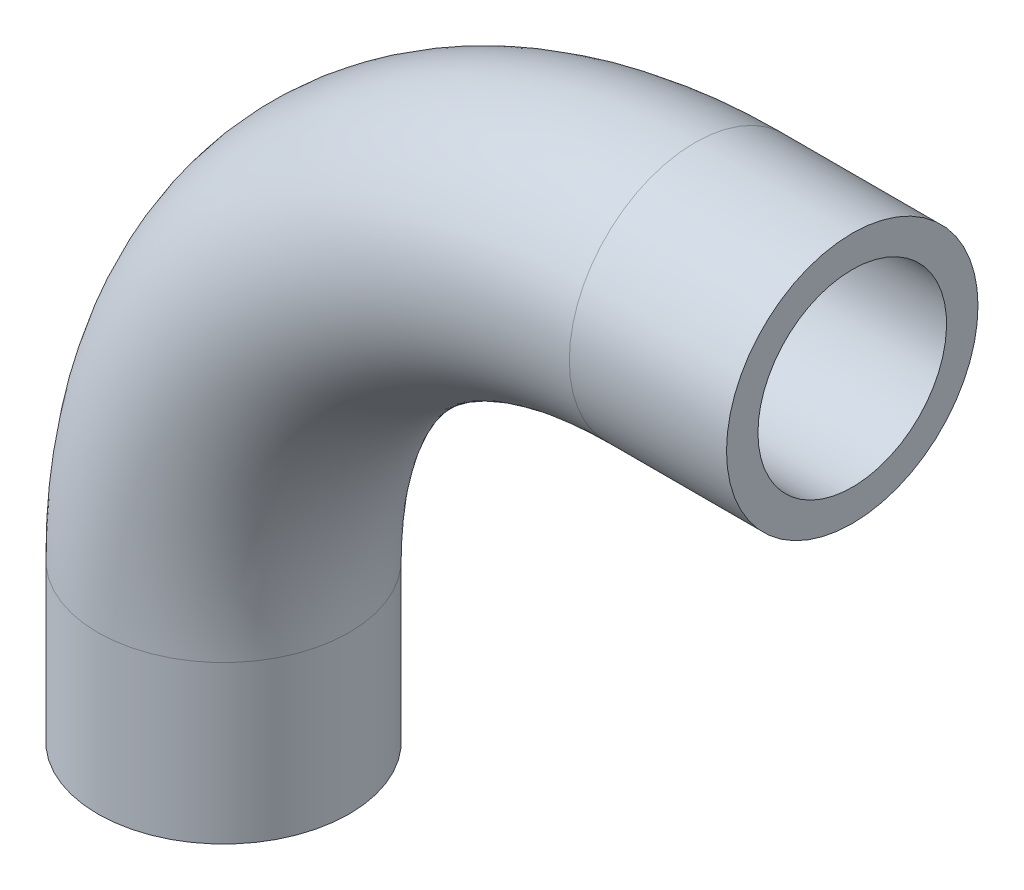
from build123d import *

# Parameters (mm, degrees)
SKETCH2_R   = 4
SKETCH2_R_2 = 3


with BuildPart() as part:
    # Sweep1: sweep along a path in Sketch1
    with BuildLine(Plane.XY) as sweep1_path:
        Line((0, 0), (0, 5))
        ThreePointArc((0, 5), (4.393398282, 15.606601718), (15, 20))
        Line((15, 20), (20, 20))
    # Sketch2 → Sweep1 (sweep)
    with BuildSketch(Plane(origin=(0, 0, 0), x_dir=(1, 0, 0), z_dir=(0, 1, 0))):
        Circle(SKETCH2_R)
        Circle(SKETCH2_R_2, mode=Mode.SUBTRACT)
    sweep(path=sweep1_path.line)


solid = part.part
